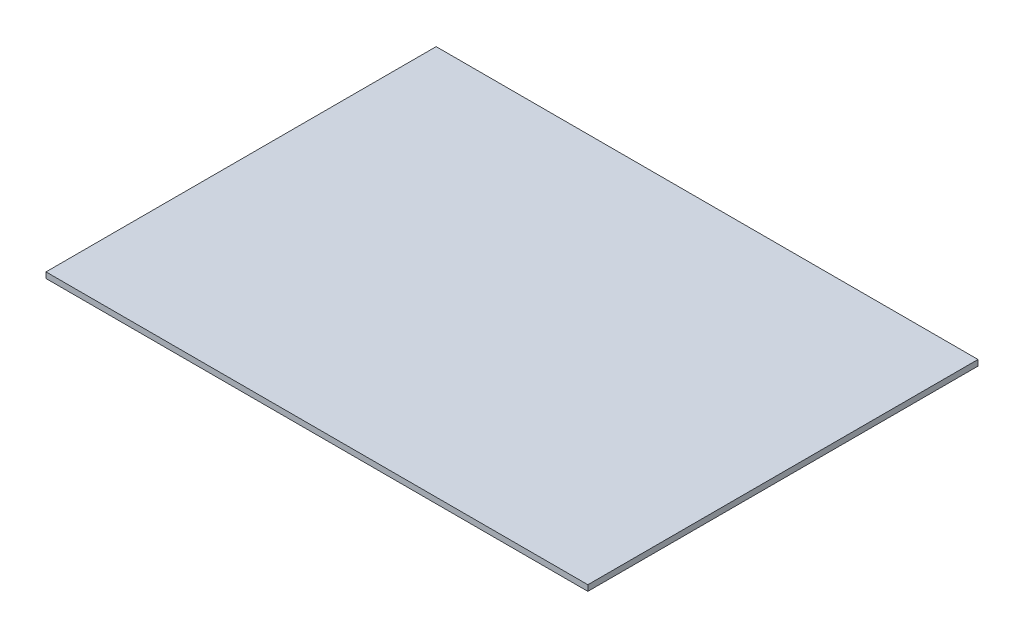
from build123d import *

# Parameters (mm, degrees)
ESQUISSE1_W        = 150
ESQUISSE1_H        = 108
BOSS_EXTRU_1_DEPTH = 1.6


with BuildPart() as part:
    # Esquisse1 → Boss.-Extru.1 (new body)
    with BuildSketch(Plane(origin=(0, 0, 0), x_dir=(1, 0, 0), z_dir=(0, 1, 0))):
        Rectangle(ESQUISSE1_W, ESQUISSE1_H)
    extrude(amount=BOSS_EXTRU_1_DEPTH)


solid = part.part
